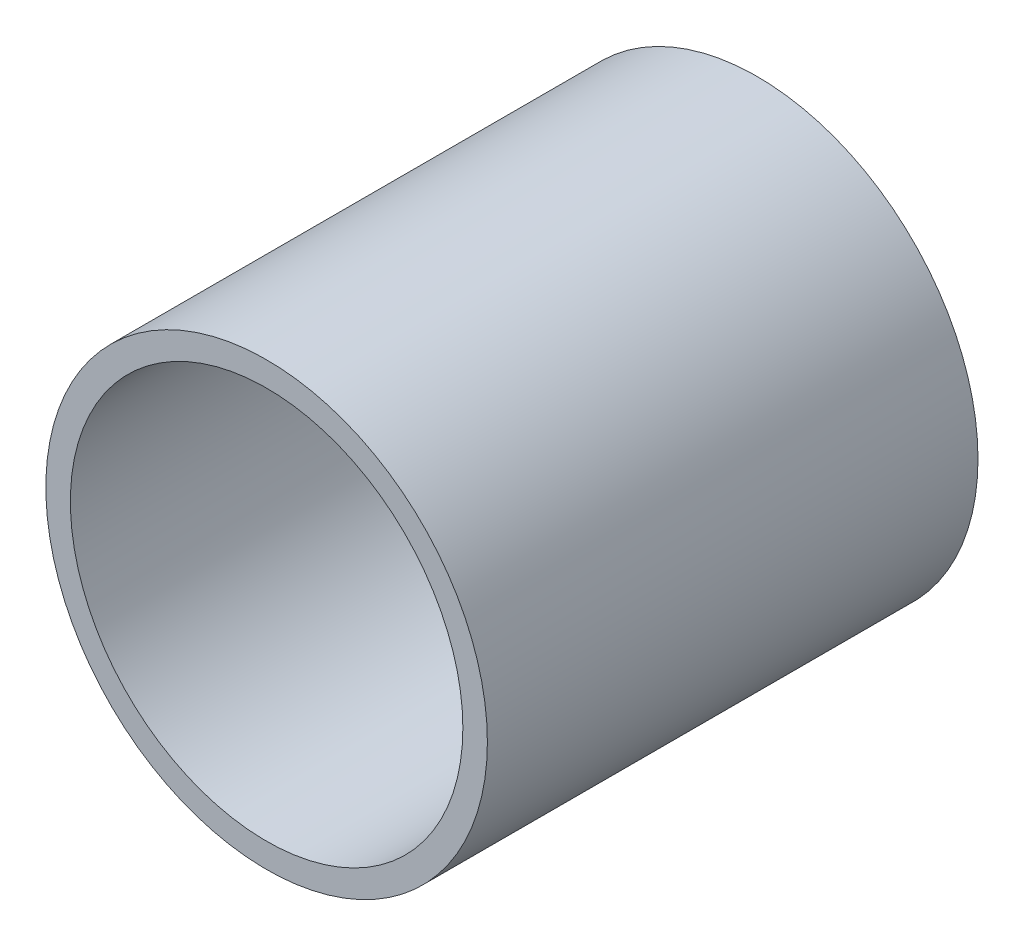
from build123d import *

# Parameters (mm, degrees)
IZIM1_R                     = 9
IZIM1_R_2                   = 8
Y_KSEKLIK_EKSTR_ZYON1_DEPTH = 20


with BuildPart() as part:
    # Çizim1 → Yükseklik-Ekstrüzyon1 (new body)
    with BuildSketch(Plane.XY):
        Circle(IZIM1_R)
        Circle(IZIM1_R_2, mode=Mode.SUBTRACT)
    extrude(amount=Y_KSEKLIK_EKSTR_ZYON1_DEPTH)


solid = part.part
